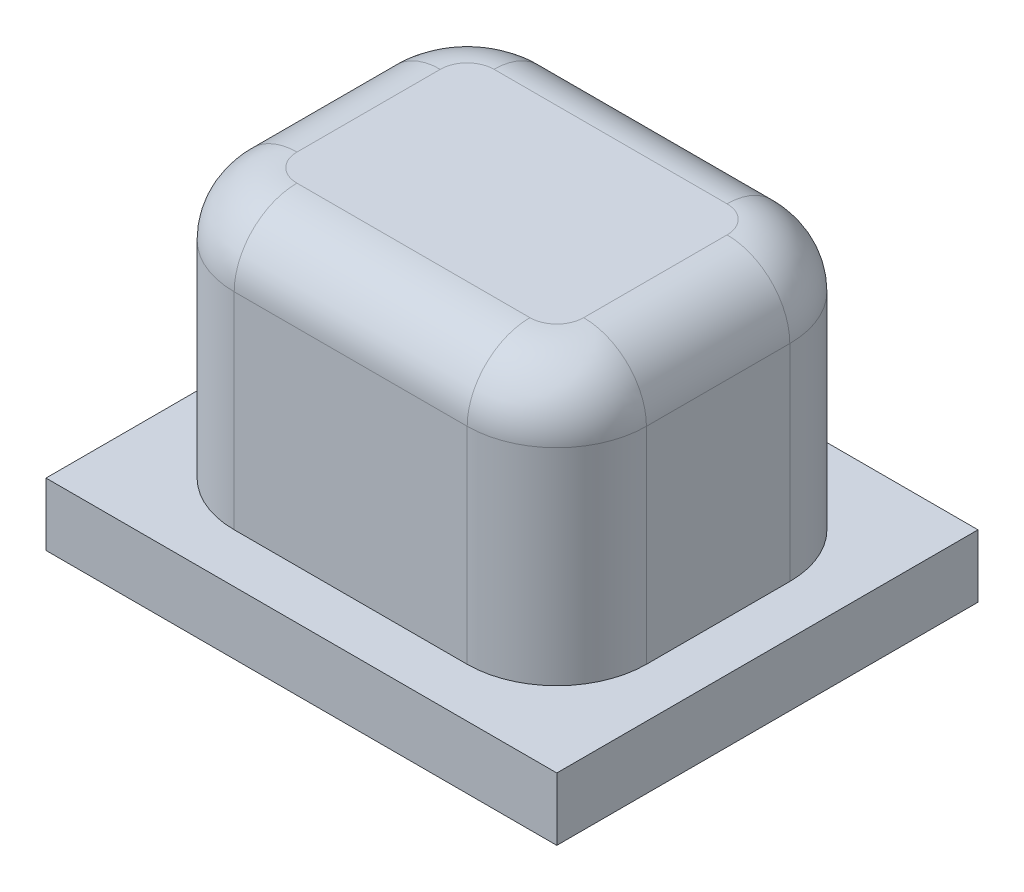
from build123d import *

# Parameters (mm, degrees)
EXTRUDE_332_DEPTH     = 3
SKETCH_2_W            = 5.7
SKETCH_2_H            = 4.7
EXTRUDE_566_DEPTH     = 0.7
CUT_EXTRUDE_806_DEPTH = 2.8
FILLET_1_R            = 0.7


with BuildPart() as part:
    # 草图1 → Extrude 332 (new body)
    with BuildSketch(Plane(origin=(0, 0, 0), x_dir=(1, 0, 0), z_dir=(0, 1, 0))):
        with BuildLine():
            Line((-1.3, -1.8), (1.3, -1.8))
            ThreePointArc((1.3, -1.8), (2.007106781, -1.507106781), (2.3, -0.8))
            Line((2.3, -0.8), (2.3, 0.8))
            ThreePointArc((2.3, 0.8), (2.007106781, 1.507106781), (1.3, 1.8))
            Line((1.3, 1.8), (-1.3, 1.8))
            ThreePointArc((-1.3, 1.8), (-2.007106781, 1.507106781), (-2.3, 0.8))
            Line((-2.3, 0.8), (-2.3, -0.8))
            ThreePointArc((-2.3, -0.8), (-2.007106781, -1.507106781), (-1.3, -1.8))
        make_face()
    extrude(amount=EXTRUDE_332_DEPTH)

    # 草图2 → Extrude 566 (add)
    with BuildSketch(Plane.XZ):
        Rectangle(SKETCH_2_W, SKETCH_2_H)
    extrude(amount=EXTRUDE_566_DEPTH)

    # 草图3 → Cut-Extrude 806 (cut)
    with BuildSketch(Plane.XZ.offset(0.7)):
        with BuildLine():
            Line((-0.75, -1.25), (0.75, -1.25))
            ThreePointArc((0.75, -1.25), (1.457106781, -0.957106781), (1.75, -0.25))
            Line((1.75, -0.25), (1.75, 0.25))
            ThreePointArc((1.75, 0.25), (1.457106781, 0.957106781), (0.75, 1.25))
            Line((0.75, 1.25), (-0.75, 1.25))
            ThreePointArc((-0.75, 1.25), (-1.457106781, 0.957106781), (-1.75, 0.25))
            Line((-1.75, 0.25), (-1.75, -0.25))
            ThreePointArc((-1.75, -0.25), (-1.457106781, -0.957106781), (-0.75, -1.25))
        make_face()
    extrude(amount=-CUT_EXTRUDE_806_DEPTH, mode=Mode.SUBTRACT)

    # 圆角1
    fillet_1_edges = [part.edges().sort_by_distance(p)[0] for p in [
        (2.007106781, 3, -1.507106781),
        (0, 3, -1.8),
        (-2.007106781, 3, -1.507106781),
        (-2.3, 3, 0),
        (-2.007106781, 3, 1.507106781),
        (0, 3, 1.8),
        (2.007106781, 3, 1.507106781),
        (2.3, 3, 0),
    ]]
    fillet(fillet_1_edges, radius=FILLET_1_R)


solid = part.part
